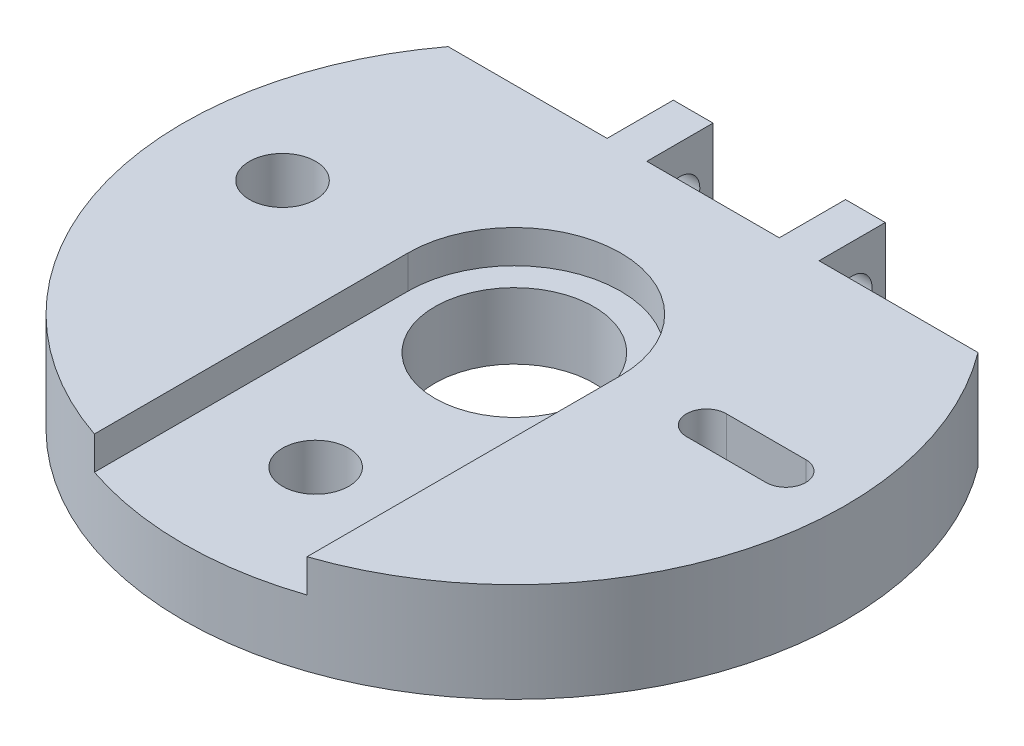
from build123d import *

# Parameters (mm, degrees)
SCHIZZO1_R                    = 12
SCHIZZO1_R_2                  = 5
ESTRUSIONE_ESTRUSIONE1_DEPTH  = 7.5
TAGLIO_ESTRUSIONE1_DEPTH      = 73.284161474
TAGLIO_ESTRUSIONE1_DEPTH_BACK = 5
SCHIZZO3_R                    = 5
SCHIZZO4_R                    = 5
TAGLIO_ESTRUSIONE2_DEPTH      = 10
FORO_7_0_7_1_D                = 7
FORO_6_0_6_1_D                = 6


with BuildPart() as part:
    # Schizzo1 → Estrusione-Estrusione1 (new, symmetric)
    with BuildSketch(Plane(origin=(0, 0, 0), x_dir=(1, 0, 0), z_dir=(0, 1, 0))):
        with BuildLine():
            Line((-40, 30), (-16, 30))
            Line((-16, 30), (-16, 40))
            Line((-16, 40), (-10, 40))
            Line((-10, 40), (-10, 30))
            Line((-10, 30), (10, 30))
            Line((10, 30), (10, 40))
            Line((10, 40), (16, 40))
            Line((16, 40), (16, 30))
            Line((16, 30), (40, 30))
            ThreePointArc((40, 30), (0, -50), (-40, 30))
        make_face()
        with Locations(Location((0, 0, 0), (0, 0, 270))):
            Circle(SCHIZZO1_R, mode=Mode.SUBTRACT)
        with Locations(Location((0, -30, 0), (0, 0, 270))):
            Circle(SCHIZZO1_R_2, mode=Mode.SUBTRACT)
        with BuildLine():
            Line((29, 3), (41, 3))
            ThreePointArc((41, 3), (44, 0), (41, -3))
            Line((41, -3), (29, -3))
            ThreePointArc((29, -3), (26, 0), (29, 3))
        make_face(mode=Mode.SUBTRACT)
    extrude(amount=ESTRUSIONE_ESTRUSIONE1_DEPTH, both=True)

    # Schizzo3 → Taglio-Estrusione1 (cut, two sides: drawn at the far end of the back side and taken through both)
    # profile 1 of 2: a face of its own
    with BuildSketch(Plane(origin=(0, 7.5, 0), x_dir=(1, 0, 0), z_dir=(0, 1, 0)).offset(-TAGLIO_ESTRUSIONE1_DEPTH_BACK)):
        with BuildLine():
            Line((16.05, 0), (12, 0))
            ThreePointArc((12, 0), (0, -12), (-12, 0))
            Line((-12, 0), (-16.05, 0))
            Line((-16.05, 0), (-16.05, -47.353959708))
            ThreePointArc((-16.05, -47.353959708), (0, -50), (16.05, -47.353959708))
            Line((16.05, -47.353959708), (16.05, 0))
        make_face()
        with Locations(Location((0, -30, 0), (0, 0, 270))):
            Circle(SCHIZZO3_R, mode=Mode.SUBTRACT)
    # profile 2 of 2: a face of its own
    with BuildSketch(Plane(origin=(0, 7.5, 0), x_dir=(1, 0, 0), z_dir=(0, 1, 0)).offset(-TAGLIO_ESTRUSIONE1_DEPTH_BACK)):
        with BuildLine():
            ThreePointArc((-12, 0), (0, 12), (12, 0))
            Line((12, 0), (16.05, 0))
            ThreePointArc((16.05, 0), (0, 16.05), (-16.05, 0))
            Line((-16.05, 0), (-12, 0))
        make_face()
    extrude(amount=TAGLIO_ESTRUSIONE1_DEPTH + TAGLIO_ESTRUSIONE1_DEPTH_BACK, mode=Mode.SUBTRACT)

    # Schizzo4 → Taglio-Estrusione2 (cut)
    with BuildSketch(Plane(origin=(0, 7.5, 0), x_dir=(1, 0, 0), z_dir=(0, 1, 0))):
        with Locations(Location((-35, 0, 0), (0, 0, 270))):
            Circle(SCHIZZO4_R)
    extrude(amount=-TAGLIO_ESTRUSIONE2_DEPTH, mode=Mode.SUBTRACT)

    # Foro Ø7.0 (7)-1 (through all)
    with Locations(Plane(origin=(0, -2.5, 0), x_dir=(1, 0, 0), z_dir=(0, 1, 0))):
        with Locations((-35, 0)):
            Hole(FORO_7_0_7_1_D / 2)

    # Foro Ø6.0 (6)-1 (through all)
    with Locations(Plane.ZY.offset(16)):
        with Locations((-35, 0)):
            Hole(FORO_6_0_6_1_D / 2)


solid = part.part
